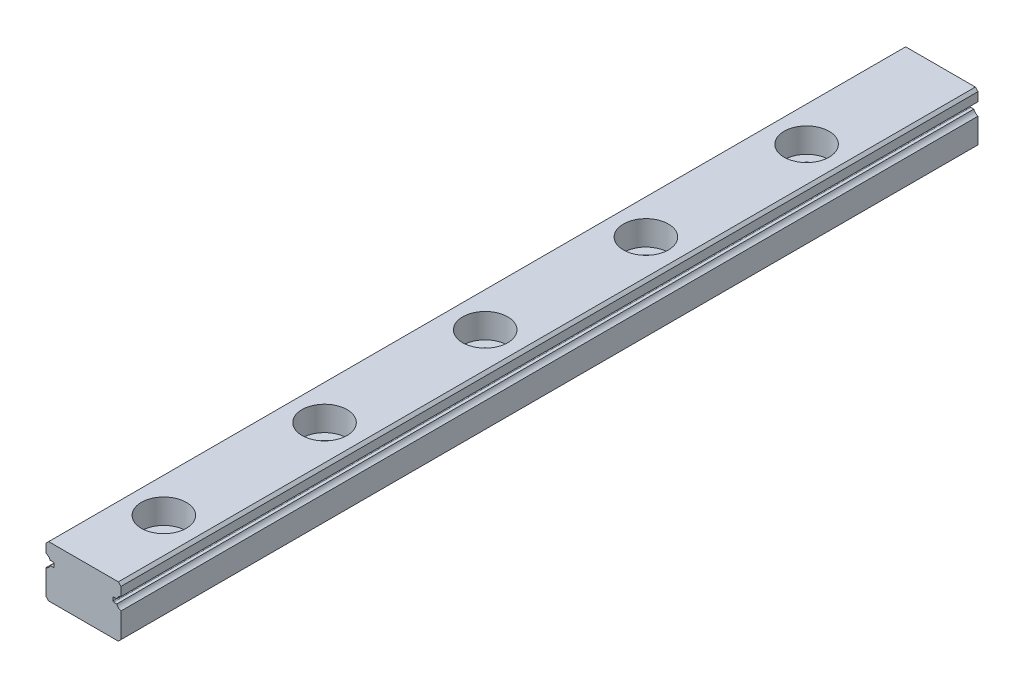
from build123d import *

# Parameters (mm, degrees)
EXTRUDE_1_DEPTH        = 80
PATTERN_LINEAR_1_COUNT = 5
PATTERN_LINEAR_1_PITCH = 15


with BuildPart() as part:
    # 草图2 → 凸台-拉伸1 (new body)
    with BuildSketch(Plane.XY):
        with BuildLine():
            Line((3.2525, 4.8), (-3.2525, 4.8))
            Line((-3.2525, 4.8), (-3.5, 4.5525))
            Line((-3.5, 4.5525), (-3.5, 3.73125))
            ThreePointArc((-3.5, 3.73125), (-3.259017021, 3.592079997), (-3.105459341, 3.36))
            Line((-3.105459341, 3.36), (-2.825459341, 3.36))
            ThreePointArc((-2.825459341, 3.36), (-2.775961866, 3.339497475), (-2.755459341, 3.29))
            Line((-2.755459341, 3.29), (-2.755459341, 3.01))
            ThreePointArc((-2.755459341, 3.01), (-2.775961866, 2.960502525), (-2.825459341, 2.94))
            Line((-2.825459341, 2.94), (-3.105459341, 2.94))
            ThreePointArc((-3.105459341, 2.94), (-3.259017021, 2.707920003), (-3.5, 2.56875))
            Line((-3.5, 2.56875), (-3.5, 0.2475))
            Line((-3.5, 0.2475), (-3.2525, 0))
            Line((-3.2525, 0), (3.2525, 0))
            Line((3.2525, 0), (3.5, 0.2475))
            Line((3.5, 0.2475), (3.5, 2.56875))
            ThreePointArc((3.5, 2.56875), (3.259017021, 2.707920003), (3.105459341, 2.94))
            Line((3.105459341, 2.94), (2.825459341, 2.94))
            ThreePointArc((2.825459341, 2.94), (2.775961866, 2.960502525), (2.755459341, 3.01))
            Line((2.755459341, 3.01), (2.755459341, 3.29))
            ThreePointArc((2.755459341, 3.29), (2.775961866, 3.339497475), (2.825459341, 3.36))
            Line((2.825459341, 3.36), (3.105459341, 3.36))
            ThreePointArc((3.105459341, 3.36), (3.259017021, 3.592079997), (3.5, 3.73125))
            Line((3.5, 3.73125), (3.5, 4.5525))
            Line((3.5, 4.5525), (3.2525, 4.8))
        make_face()
    extrude(amount=-EXTRUDE_1_DEPTH)

    # 草图3 → 切除-旋转1 (revolve, cut)
    with BuildSketch(Plane(origin=(0, 0, 0), x_dir=(0, 0, -1), z_dir=(1, 0, 0))):
        Polygon((5.4, 4.8), (5.4, 2.5), (6.3, 2.5), (6.3, 0), (7.5, 0), (7.5, 4.8), align=None)
    cut_revolve_1 = revolve(axis=Axis((0, 4.8, -7.5), (0, -1, 0)), mode=Mode.SUBTRACT)

    # 阵列(线性)1: 切除-旋转1 ×5
    with Locations(*[(0, 0, -i * PATTERN_LINEAR_1_PITCH) for i in range(1, PATTERN_LINEAR_1_COUNT)]):
        add(cut_revolve_1, mode=Mode.SUBTRACT)


solid = part.part
